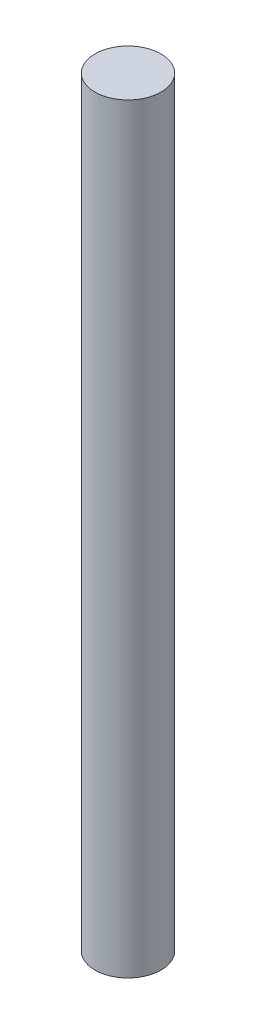
from build123d import *

# Parameters (mm, degrees)
CROQUIS1_R              = 4
SALIENTE_EXTRUIR1_DEPTH = 92


with BuildPart() as part:
    # Croquis1 → Saliente-Extruir1 (new body)
    with BuildSketch(Plane(origin=(0, 0, 0), x_dir=(1, 0, 0), z_dir=(0, 1, 0))):
        with Locations(Location((0, 0, 0), (0, 0, 270))):
            Circle(CROQUIS1_R)
    extrude(amount=SALIENTE_EXTRUIR1_DEPTH)


solid = part.part
